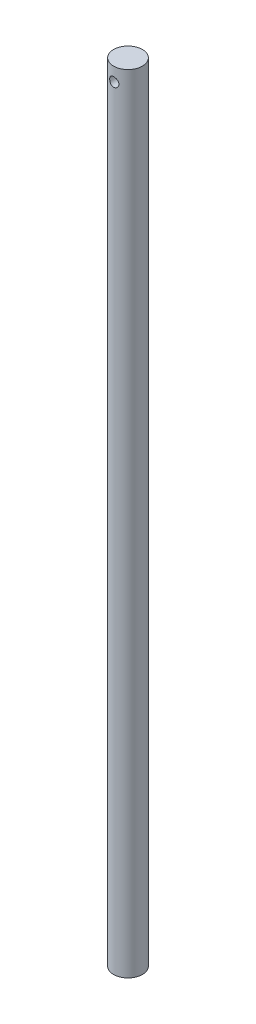
from build123d import *

# Parameters (mm, degrees)
SKETCH1_R               = 9.906
BOSS_EXTRUDE1_DEPTH     = 539.75
CUT_EXTRUDE1_DEPTH      = 540.931773627
CUT_EXTRUDE1_DEPTH_BACK = 540.931773627
SKETCH2_R               = 3.175


with BuildPart() as part:
    # Sketch1 → Boss-Extrude1 (new body)
    with BuildSketch(Plane(origin=(0, 0, 0), x_dir=(1, 0, 0), z_dir=(0, 1, 0))):
        with Locations(Location((0, 0, 0), (0, 0, 270))):
            Circle(SKETCH1_R)
    extrude(amount=BOSS_EXTRUDE1_DEPTH)

    # Sketch2 → Cut-Extrude1 (cut, two sides: drawn at the far end of the back side and taken through both)
    with BuildSketch(Plane.XY.offset(-CUT_EXTRUDE1_DEPTH_BACK)):
        with Locations(Location((0, 530.352, 0), (0, 0, 89.99999999))):
            Circle(SKETCH2_R)
    extrude(amount=CUT_EXTRUDE1_DEPTH + CUT_EXTRUDE1_DEPTH_BACK, mode=Mode.SUBTRACT)


solid = part.part
